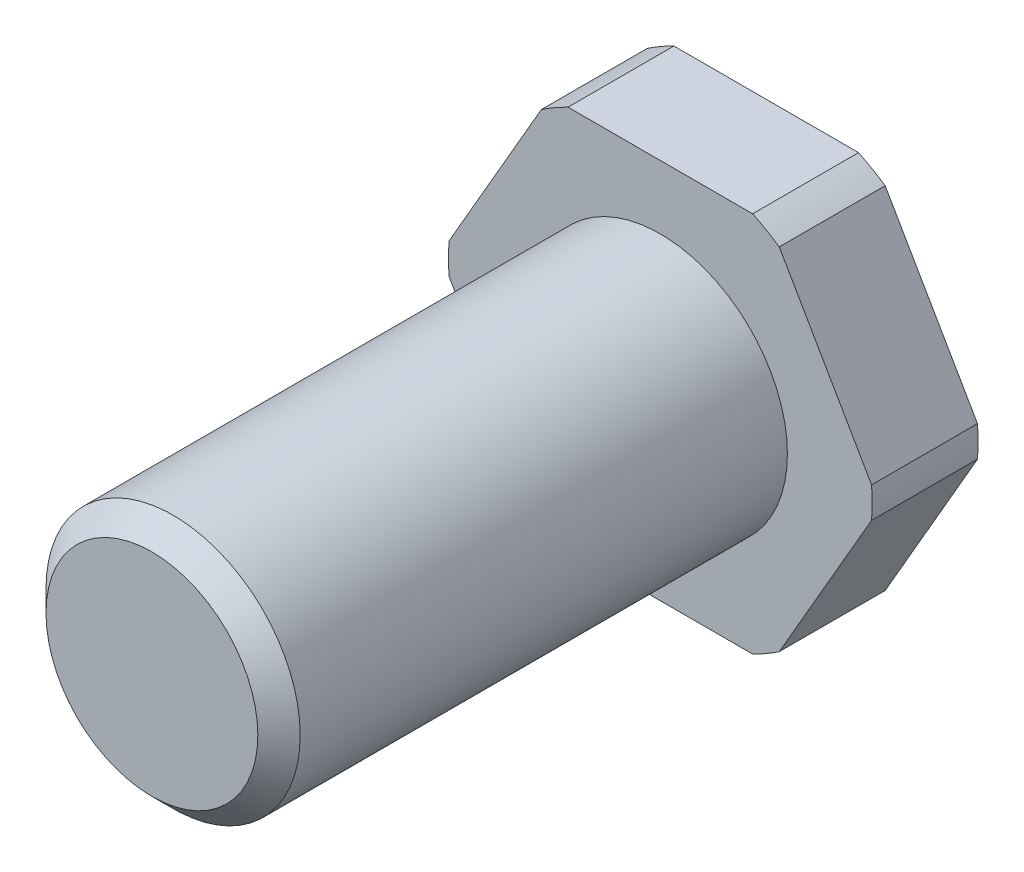
from build123d import *

# Parameters (mm, degrees)
EXTRUDE_1_DEPTH     = 5
SKETCH_2_R          = 6
EXTRUDE_2_DEPTH     = 24
M8X1_25_1_D         = 6.8
M8X1_25_1_DEPTH     = 15
M8X1_25_1_TIP       = 2.042926105
SKETCH_5_OUTSIDE_W  = 30.776
SKETCH_5_OUTSIDE_H  = 27.992
SKETCH_5_OUTSIDE_R  = 10
CUT_EXTRUDE_1_DEPTH = 28.658633372
CHAMFER_1_SIZE      = 1


with BuildPart() as part:
    # 草图1 → 凸台-拉伸1 (new body)
    with BuildSketch(Plane.XY):
        Polygon((10.392304845, 0), (5.196152423, 9), (-5.196152423, 9), (-10.392304845, 0), (-5.196152423, -9), (5.196152423, -9), align=None)
    extrude(amount=EXTRUDE_1_DEPTH)

    # 草图2 → 凸台-拉伸2 (add)
    with BuildSketch(Plane.XY.offset(5)):
        Circle(SKETCH_2_R)
    extrude(amount=EXTRUDE_2_DEPTH)

    # M8x1.25 螺纹孔1
    with Locations(Plane(origin=(-3.351254267, -2.461520779, 0), x_dir=(1, 0, 0), z_dir=(0, 0, -1))):
        with Locations((3.351254267, -2.461520779)):
            Hole(M8X1_25_1_D / 2, depth=M8X1_25_1_DEPTH)
            with Locations((0, 0, -(M8X1_25_1_DEPTH + M8X1_25_1_TIP / 2))):  # 118° drill point
                Cone(0, M8X1_25_1_D / 2, M8X1_25_1_TIP, mode=Mode.SUBTRACT)

    # 草图5 outside → 切除-拉伸1 (cut, through all)
    with BuildSketch(Plane.XY.offset(5)):
        Rectangle(SKETCH_5_OUTSIDE_W, SKETCH_5_OUTSIDE_H)
        Circle(SKETCH_5_OUTSIDE_R, mode=Mode.SUBTRACT)
    extrude(amount=-CUT_EXTRUDE_1_DEPTH, mode=Mode.SUBTRACT)

    # 倒角1
    chamfer_1_edges = [part.edges().sort_by_distance(p)[0] for p in [
        (-6, 0, 29),
    ]]
    chamfer(chamfer_1_edges, length=CHAMFER_1_SIZE)


solid = part.part
